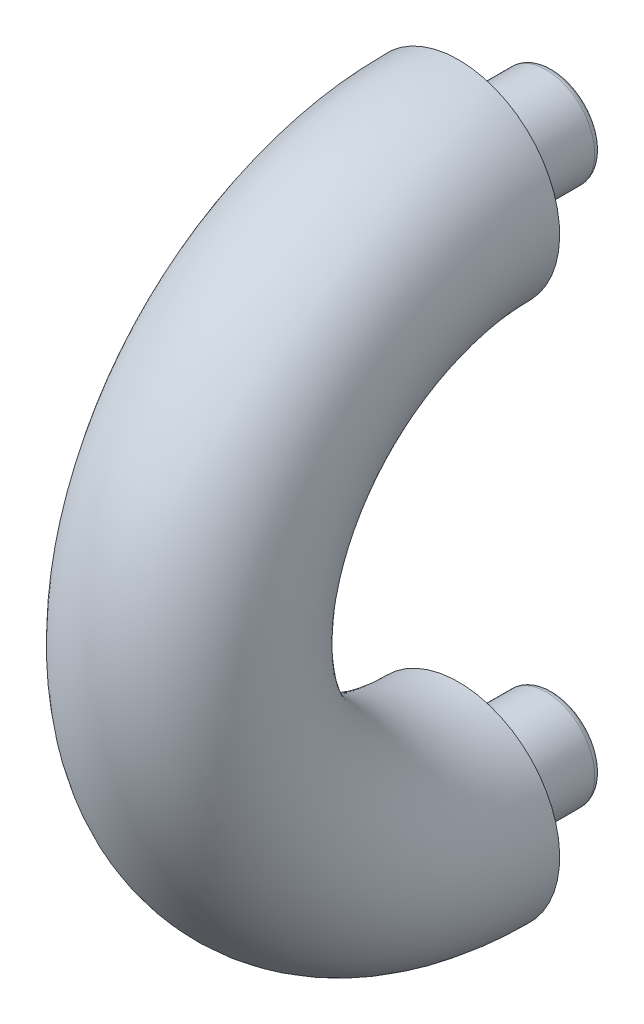
from build123d import *

# Parameters (mm, degrees)
SWEEP1_PROFILE_R        = 19.05
CUT_EXTRUDE1_DEPTH      = 63.5
CUT_EXTRUDE1_DEPTH_BACK = 73.406
SKETCH8_W               = 178.900879979
SKETCH8_H               = 78.070926248
SKETCH9_R               = 9.144
BOSS_EXTRUDE1_DEPTH     = 17.78
FILLET1_R               = 1.27
FILLET2_R               = 1.27


with BuildPart() as part:
    # Sweep1: sweep along a path in Sketch1
    with BuildLine(Plane.YZ) as sweep1_path:
        CenterArc((0, 0), 50.8, 0, 360)
    # Sweep1 profile (on start of the path) → Sweep1 (sweep)
    with BuildSketch(Plane(origin=(0, 50.8, 0), x_dir=(1, 0, 0), z_dir=(0, 0, 1))):
        Circle(SWEEP1_PROFILE_R)
    sweep(path=sweep1_path.line)

    # Sketch8 → Cut-Extrude1 (cut, two sides: drawn at the far end of the back side and taken through both)
    with BuildSketch(Plane.YZ.offset(-CUT_EXTRUDE1_DEPTH_BACK)):
        with Locations((-6.435954493, -39.035463124)):
            Rectangle(SKETCH8_W, SKETCH8_H)
    extrude(amount=CUT_EXTRUDE1_DEPTH + CUT_EXTRUDE1_DEPTH_BACK, mode=Mode.SUBTRACT)

    # Sketch9 → Boss-Extrude1 (add)
    with BuildSketch(Plane(origin=(0, 0, 0), x_dir=(1, 0, 0), z_dir=(0, 0, -1))):
        with Locations(Location((0, 50.8, 0), (0, 0, 180))):
            Circle(SKETCH9_R)
        with Locations(Location((0, -50.8, 0), (0, 0, 180))):
            Circle(SKETCH9_R)
    extrude(amount=BOSS_EXTRUDE1_DEPTH)

    # Fillet1
    fillet1_edges = [part.edges().sort_by_distance(p)[0] for p in [
        (9.144, -50.8, -17.78),
        (9.144, 50.8, -17.78),
    ]]
    fillet(fillet1_edges, radius=FILLET1_R)

    # Fillet2
    fillet2_edges = [part.edges().sort_by_distance(p)[0] for p in [
        (9.144, -50.8, 0),
        (9.144, 50.8, 0),
    ]]
    fillet(fillet2_edges, radius=FILLET2_R)


solid = part.part
